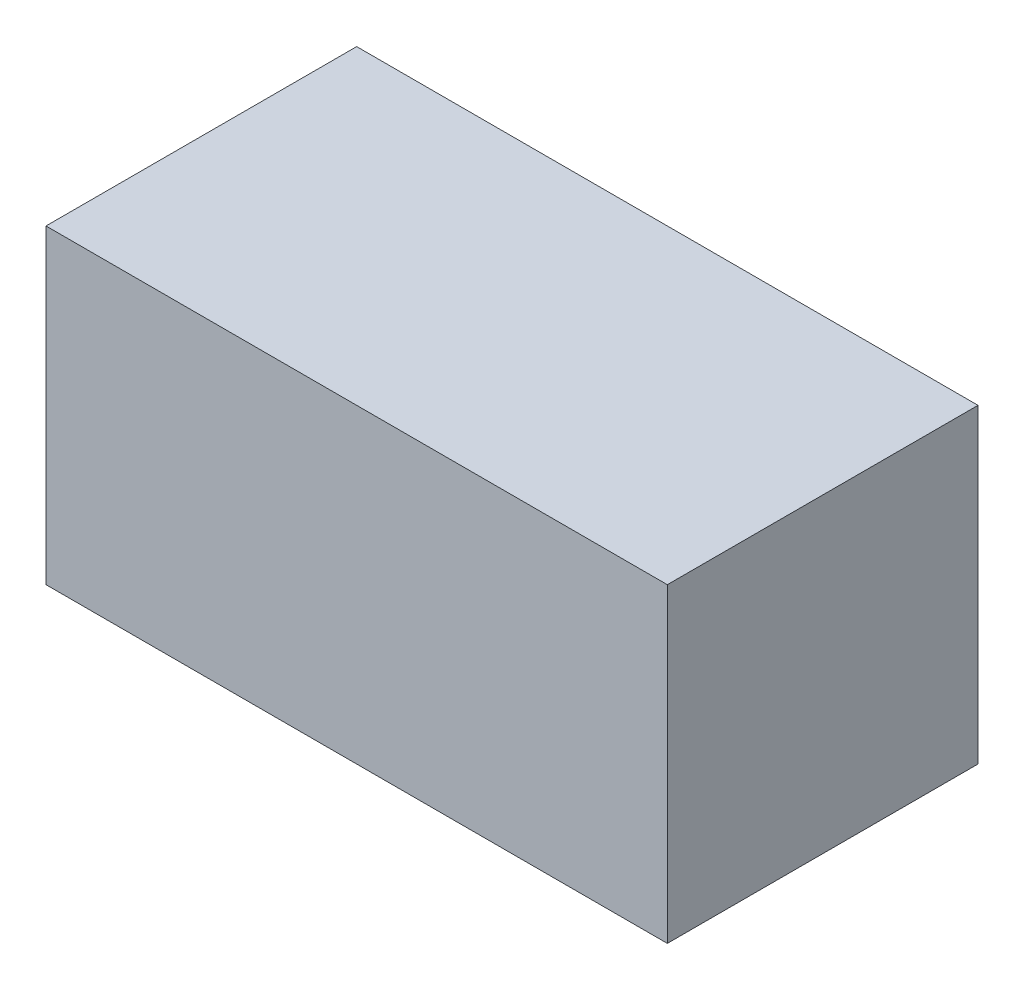
from build123d import *

# Parameters (mm, degrees)
SKETCH1_W           = 40
SKETCH1_H           = 20
BOSS_EXTRUDE1_DEPTH = 10
SKETCH2_R           = 4
CUT_EXTRUDE1_DEPTH  = 46.82575695


with BuildPart() as part:
    # Sketch1 → Boss-Extrude1 (new, symmetric)
    with BuildSketch(Plane.XY):
        with Locations((20, 10)):
            Rectangle(SKETCH1_W, SKETCH1_H)
    extrude(amount=BOSS_EXTRUDE1_DEPTH, both=True)

    # Sketch2 → Cut-Extrude1 (cut, through all)
    with BuildSketch(Plane.XY):
        with Locations((20, 10)):
            Circle(SKETCH2_R)
    extrude(amount=-CUT_EXTRUDE1_DEPTH, mode=Mode.SUBTRACT)


solid = part.part
